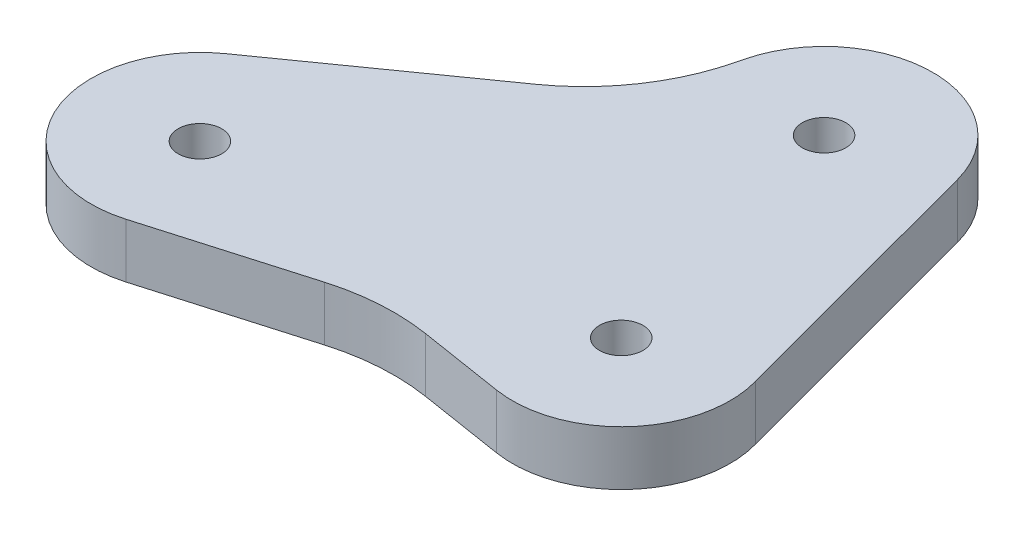
from build123d import *

# Parameters (mm, degrees)
SKIZZE1_R                       = 2
AUFSATZ_LINEAR_AUSTRAGEN1_DEPTH = 5
VERRUNDUNG1_R                   = 19
VERRUNDUNG2_R                   = 20


with BuildPart() as part:
    # Skizze1 → Aufsatz-Linear austragen1 (new body)
    with BuildSketch(Plane(origin=(0, 0, 0), x_dir=(1, 0, 0), z_dir=(0, 1, 0))):
        with BuildLine():
            Line((32.174930969, -0.758710751), (25.406405474, 24.546237926))
            ThreePointArc((25.406405474, 24.546237926), (15.641921228, 31.961749958), (6.033920269, 24.344579298))
            Line((6.033920269, 24.344579298), (4.193711044, 16.842429276))
            Line((4.193711044, 16.842429276), (-18.224781404, 0.973862232))
            ThreePointArc((-18.224781404, 0.973862232), (-21.454022597, -11.53334461), (-9.654845468, -16.790495999))
            Line((-9.654845468, -16.790495999), (8.801061186, -11.423209418))
            Line((8.801061186, -11.423209418), (20.984655174, -13.357550953))
            ThreePointArc((20.984655174, -13.357550953), (30.029331036, -10.12200662), (32.174930969, -0.758710751))
        make_face()
        with Locations(Location((22.552676727, -3.481250613, 0), (0, 0, 270))):
            Circle(SKIZZE1_R, mode=Mode.SUBTRACT)
        with Locations(Location((-12.447323273, -7.188305222, 0), (0, 0, 270))):
            Circle(SKIZZE1_R, mode=Mode.SUBTRACT)
        with Locations(Location((15.746010972, 21.962291706, 0), (0, 0, 270))):
            Circle(SKIZZE1_R, mode=Mode.SUBTRACT)
    extrude(amount=AUFSATZ_LINEAR_AUSTRAGEN1_DEPTH)

    # Verrundung1
    verrundung1_edges = [part.edges().sort_by_distance(p)[0] for p in [
        (4.193711044, 2.5, -16.842429276),
    ]]
    fillet(verrundung1_edges, radius=VERRUNDUNG1_R)

    # Verrundung2
    verrundung2_edges = [part.edges().sort_by_distance(p)[0] for p in [
        (8.801061186, 2.5, 11.423209418),
    ]]
    fillet(verrundung2_edges, radius=VERRUNDUNG2_R)


solid = part.part
